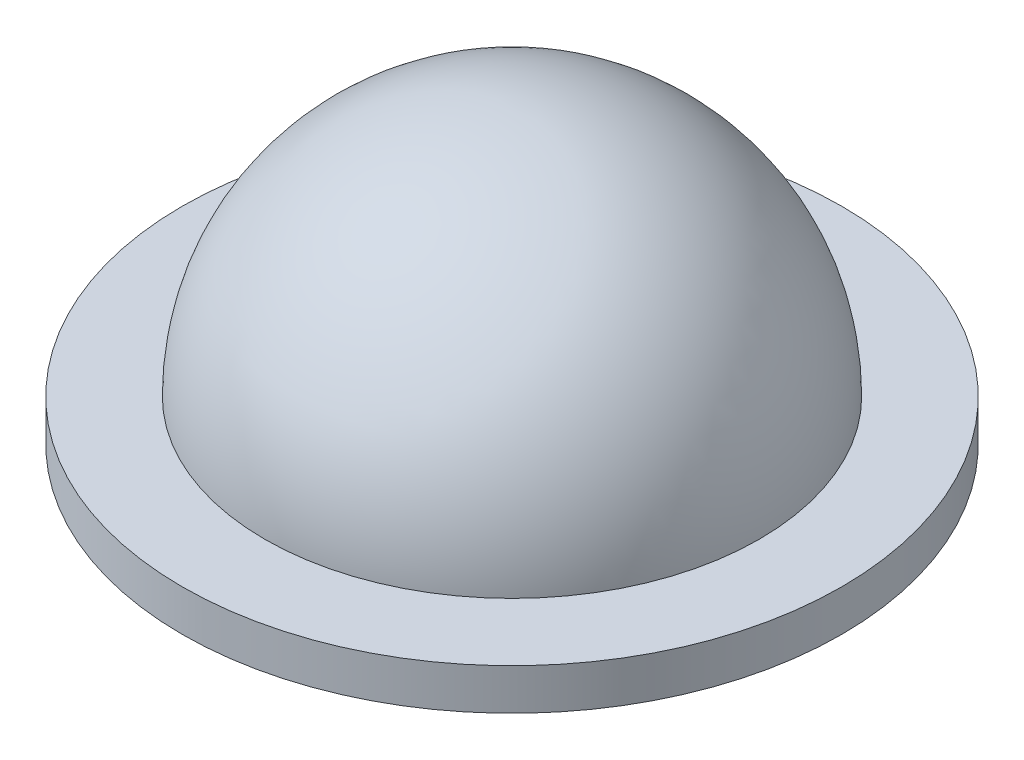
from build123d import *


with BuildPart() as part:
    # Sketch1 → Revolve1 (revolve)
    with BuildSketch(Plane.XY, mode=Mode.PRIVATE) as revolve1_sk:
        with BuildLine():
            Line((0, 0), (-3.101020514, 0))
            Line((-3.101020514, 0), (-3.101020514, 1))
            Line((-3.101020514, 1), (-1.101020514, 1))
            ThreePointArc((-1.101020514, 1), (0.656338798, 5.242640687), (4.898979486, 7))
            Line((4.898979486, 7), (4.898979486, 6))
            ThreePointArc((4.898979486, 6), (1.025996139, 4.16227766), (0, 0))
        make_face()
    revolve(revolve1_sk.sketch.rotate(Axis((4.898979486, 7, 0), (0, -1, 0)), 270), axis=Axis((4.898979486, 7, 0), (0, -1, 0)))


solid = part.part
